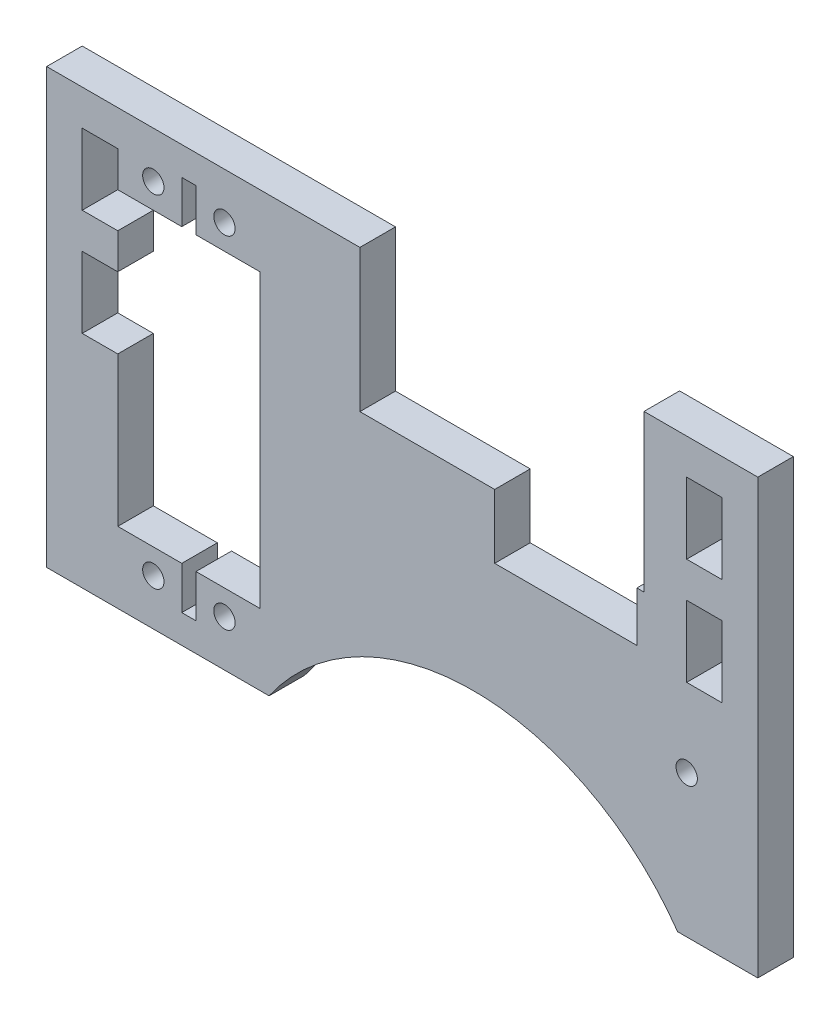
from build123d import *

# Parameters (mm, degrees)
ESQUISSE1_R        = 1.5
ESQUISSE1_W        = 5
ESQUISSE1_H        = 10
BOSS_EXTRU_1_DEPTH = 5


with BuildPart() as part:
    # Esquisse1 → Boss.-Extru.1 (new body)
    with BuildSketch(Plane.XY):
        with BuildLine():
            Line((0, 0), (31.277186767, 0))
            ThreePointArc((31.277186767, 0), (60, 15), (88.722813233, 0))
            Line((88.722813233, 0), (100, 0))
            Line((100, 0), (100, 61))
            Line((100, 61), (84, 61))
            Line((84, 61), (84, 39))
            Line((84, 39), (83, 39))
            Line((83, 39), (83, 32))
            Line((83, 32), (63, 32))
            Line((63, 32), (63, 41))
            Line((63, 41), (44.050031289, 41))
            Line((44.050031289, 41), (44.050031289, 61))
            Line((44.050031289, 61), (0, 61))
            Line((0, 61), (0, 0))
        make_face()
        with Locations((15, 6.5)):
            Circle(ESQUISSE1_R, mode=Mode.SUBTRACT)
        with Locations((25, 6.5)):
            Circle(ESQUISSE1_R, mode=Mode.SUBTRACT)
        with Locations(Location((25, 54.5, 0), (0, 0, 180))):
            Circle(ESQUISSE1_R, mode=Mode.SUBTRACT)
        with Locations(Location((15, 54.5, 0), (0, 0, 180))):
            Circle(ESQUISSE1_R, mode=Mode.SUBTRACT)
        with Locations((90, 20)):
            Circle(ESQUISSE1_R, mode=Mode.SUBTRACT)
        Polygon((10, 51), (19, 51), (19, 57), (21, 57), (21, 51), (30, 51), (30, 10), (21, 10), (21, 4), (19, 4), (19, 10), (10, 10), (10, 31), (5, 31), (5, 41), (10, 41), (10, 46), (5, 46), (5, 56), (10, 56), align=None, mode=Mode.SUBTRACT)
        with Locations((92.5, 51)):
            Rectangle(ESQUISSE1_W, ESQUISSE1_H, mode=Mode.SUBTRACT)
        with Locations((92.5, 36)):
            Rectangle(ESQUISSE1_W, ESQUISSE1_H, mode=Mode.SUBTRACT)
    extrude(amount=BOSS_EXTRU_1_DEPTH)


solid = part.part
